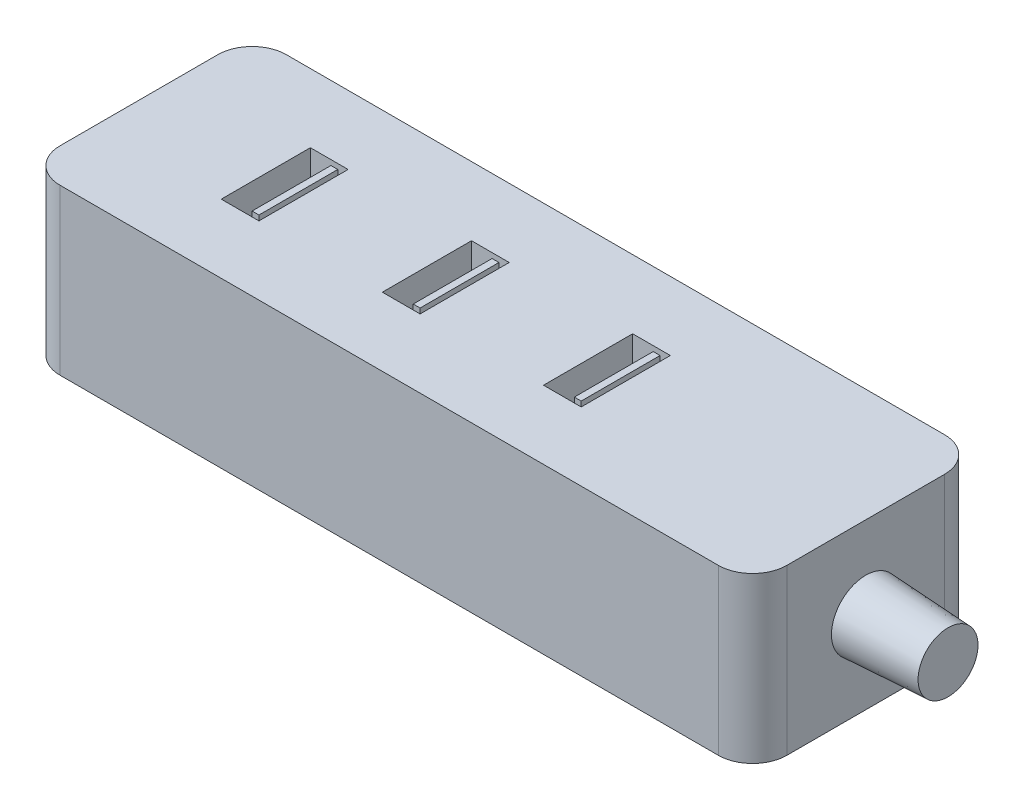
from build123d import *

# Parameters (mm, degrees)
BOSS_EXTRUDE1_DEPTH = 12
SKETCH2_W           = 5.5
SKETCH2_H           = 13
SKETCH2_W_2         = 1
SKETCH2_H_2         = 11.5
CUT_EXTRUDE1_DEPTH  = 10
SKETCH3_W           = 15.4
SKETCH3_H           = 7.5
SKETCH3_W_2         = 12.9
SKETCH3_H_2         = 1
CUT_EXTRUDE2_DEPTH  = 10
SKETCH4_R           = 5
BOSS_EXTRUDE2_DEPTH = 12
BOSS_EXTRUDE2_TAPER = 3


with BuildPart() as part:
    # Sketch1 → Boss-Extrude1 (new, symmetric)
    with BuildSketch(Plane(origin=(0, 0, 0), x_dir=(1, 0, 0), z_dir=(0, 1, 0))):
        with BuildLine():
            Line((-48, -16.5), (48, -16.5))
            ThreePointArc((48, -16.5), (51.535533906, -15.035533906), (53, -11.5))
            Line((53, -11.5), (53, 11.5))
            ThreePointArc((53, 11.5), (51.535533906, 15.035533906), (48, 16.5))
            Line((48, 16.5), (-48, 16.5))
            ThreePointArc((-48, 16.5), (-51.535533906, 15.035533906), (-53, 11.5))
            Line((-53, 11.5), (-53, -11.5))
            ThreePointArc((-53, -11.5), (-51.535533906, -15.035533906), (-48, -16.5))
        make_face()
    extrude(amount=BOSS_EXTRUDE1_DEPTH, both=True)

    # Sketch2 → Cut-Extrude1 (cut)
    # profile 1 of 3: a face of its own
    with BuildSketch(Plane(origin=(0, 12, 0), x_dir=(1, 0, 0), z_dir=(0, 1, 0))):
        with Locations((15.25, 0)):
            Rectangle(SKETCH2_W, SKETCH2_H)
        with Locations((16.75, 0)):
            Rectangle(SKETCH2_W_2, SKETCH2_H_2, mode=Mode.SUBTRACT)
    # profile 2 of 3: a face of its own
    with BuildSketch(Plane(origin=(0, 12, 0), x_dir=(1, 0, 0), z_dir=(0, 1, 0))):
        with Locations((-8.25, 0)):
            Rectangle(SKETCH2_W, SKETCH2_H)
        with Locations((-6.75, 0)):
            Rectangle(SKETCH2_W_2, SKETCH2_H_2, mode=Mode.SUBTRACT)
    # profile 3 of 3: a face of its own
    with BuildSketch(Plane(origin=(0, 12, 0), x_dir=(1, 0, 0), z_dir=(0, 1, 0))):
        with Locations((-31.75, 0)):
            Rectangle(SKETCH2_W, SKETCH2_H)
        with Locations((-30.25, 0)):
            Rectangle(SKETCH2_W_2, SKETCH2_H_2, mode=Mode.SUBTRACT)
    extrude(amount=-CUT_EXTRUDE1_DEPTH, mode=Mode.SUBTRACT)

    # Sketch3 → Cut-Extrude2 (cut)
    with BuildSketch(Plane.ZY.offset(53)):
        Rectangle(SKETCH3_W, SKETCH3_H)
        with Locations((0, 2)):
            Rectangle(SKETCH3_W_2, SKETCH3_H_2, mode=Mode.SUBTRACT)
    extrude(amount=-CUT_EXTRUDE2_DEPTH, mode=Mode.SUBTRACT)

    # Sketch4 → Boss-Extrude2 (add)
    with BuildSketch(Plane(origin=(53, 0, 0), x_dir=(0, 0, -1), z_dir=(1, 0, 0))):
        Circle(SKETCH4_R)
    extrude(amount=BOSS_EXTRUDE2_DEPTH, taper=BOSS_EXTRUDE2_TAPER)


solid = part.part
